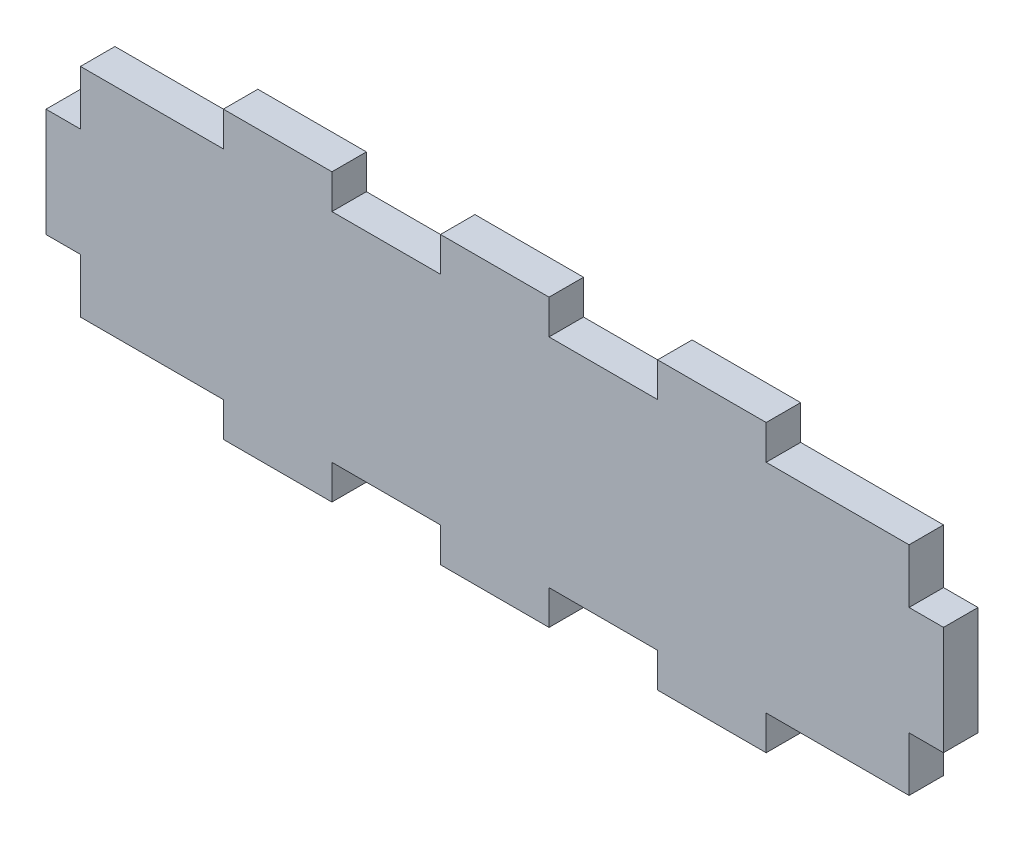
from build123d import *

# Parameters (mm, degrees)
ESQUISSE1_W             = 165.35
ESQUISSE1_H             = 52.7
BOSS_EXTRU_1_DEPTH      = 6.35
ESQUISSE3_W             = 6.35
ESQUISSE3_H             = 16.35
ENL_V_MAT_EXTRU_1_DEPTH = 88.004601171
ESQUISSE5_W             = 20
ESQUISSE5_H             = 6.35
ESQUISSE5_W_2           = 26.325
ENL_V_MAT_EXTRU_2_DEPTH = 88.004601171


with BuildPart() as part:
    # Esquisse1 → Boss.-Extru.1 (new body)
    with BuildSketch(Plane.XY):
        Rectangle(ESQUISSE1_W, ESQUISSE1_H)
    extrude(amount=BOSS_EXTRU_1_DEPTH)

    # Esquisse3 → Enlèv. mat.-Extru.1 (cut, through all)
    with BuildSketch(Plane.XY.offset(6.35)):
        with Locations((-79.5, -18.175)):
            Rectangle(ESQUISSE3_W, ESQUISSE3_H)
        with Locations((-79.5, 18.175)):
            Rectangle(ESQUISSE3_W, ESQUISSE3_H)
    enl_v_mat_extru_1 = extrude(amount=-ENL_V_MAT_EXTRU_1_DEPTH, mode=Mode.SUBTRACT)

    # Symétrie1: Enlèv. mat.-Extru.1 across plane
    add(enl_v_mat_extru_1.mirror(Plane(origin=(0, 0, 0), x_dir=(0, 0, 1), z_dir=(1, 0, 0))), mode=Mode.SUBTRACT)

    # Esquisse5 → Enlèv. mat.-Extru.2 (cut, through all)
    with BuildSketch(Plane.XY.offset(6.35)):
        with Locations((-20, -23.175)):
            Rectangle(ESQUISSE5_W, ESQUISSE5_H)
        with Locations((20, -23.175)):
            Rectangle(ESQUISSE5_W, ESQUISSE5_H)
        with Locations((63.1625, -23.175)):
            Rectangle(ESQUISSE5_W_2, ESQUISSE5_H)
        with Locations((-63.1625, -23.175)):
            Rectangle(ESQUISSE5_W_2, ESQUISSE5_H)
    enl_v_mat_extru_2 = extrude(amount=-ENL_V_MAT_EXTRU_2_DEPTH, mode=Mode.SUBTRACT)

    # Symétrie2: Enlèv. mat.-Extru.2 across plane
    add(enl_v_mat_extru_2.mirror(Plane.ZX), mode=Mode.SUBTRACT)


solid = part.part
